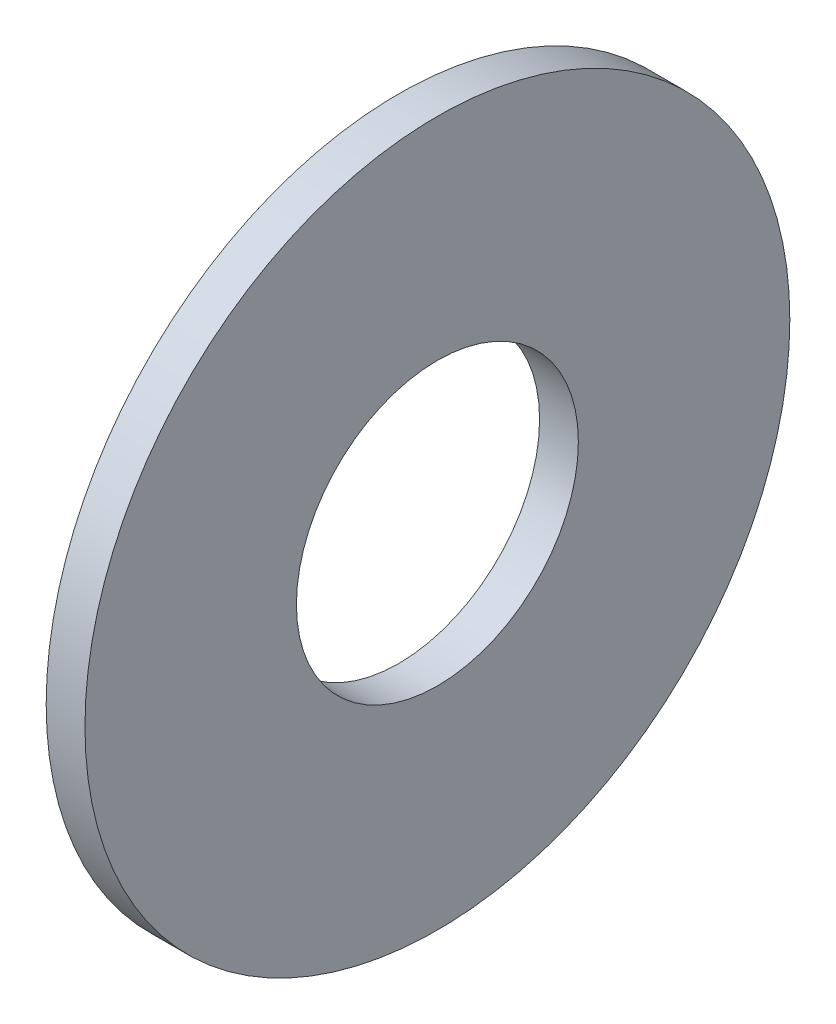
from build123d import *

# Parameters (mm, degrees)
SKETCH1_R          = 5
SKETCH1_R_2        = 2
BASE_EXTRUDE_DEPTH = 0.55


with BuildPart() as part:
    # Sketch1 → Base-Extrude (new body)
    with BuildSketch(Plane(origin=(0, 0, 0), x_dir=(0, 0, -1), z_dir=(1, 0, 0))):
        Circle(SKETCH1_R)
        Circle(SKETCH1_R_2, mode=Mode.SUBTRACT)
    extrude(amount=BASE_EXTRUDE_DEPTH)


solid = part.part
